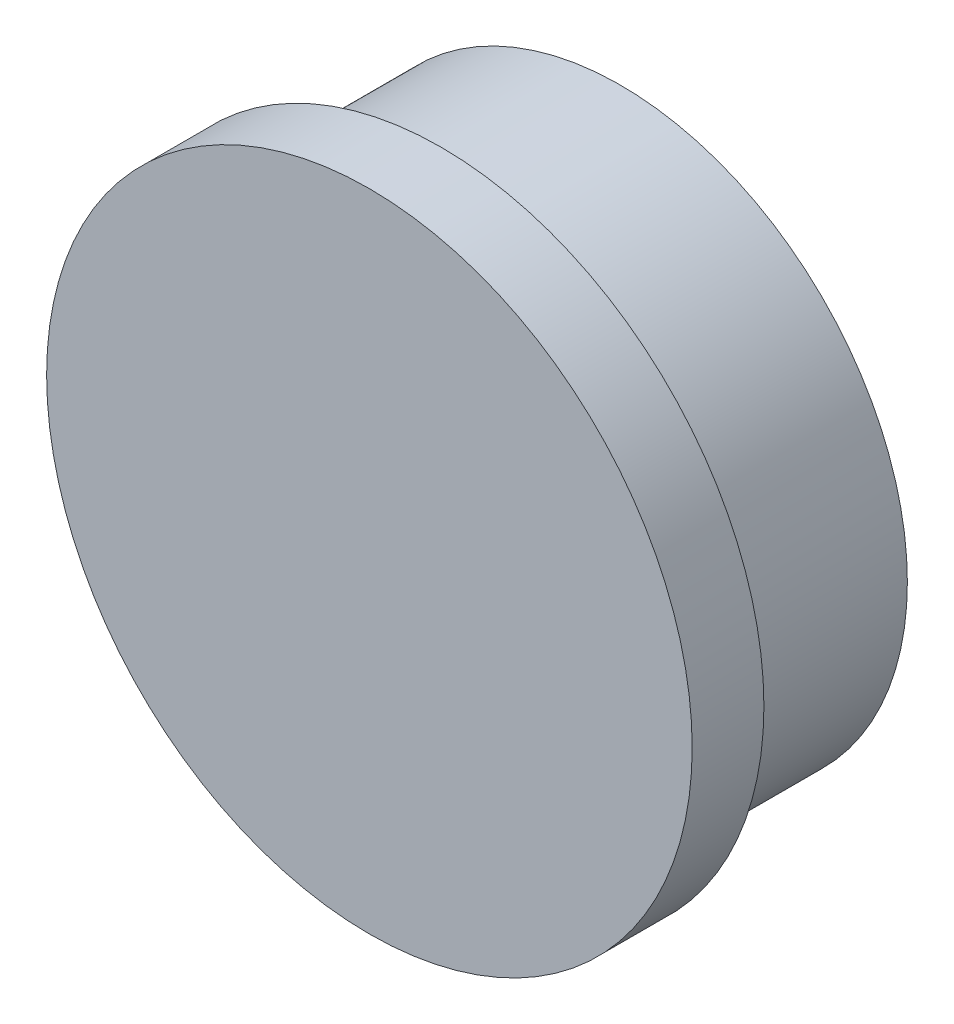
from build123d import *

# Parameters (mm, degrees)
SKETCH_1_R      = 9
EXTRUDE_1_DEPTH = 2
SKETCH_2_R      = 8
EXTRUDE_2_DEPTH = 5


with BuildPart() as part:
    # 草图1 → 凸台-拉伸1 (new body)
    with BuildSketch(Plane.XY):
        Circle(SKETCH_1_R)
    extrude(amount=EXTRUDE_1_DEPTH)

    # 草图2 → 凸台-拉伸2 (add)
    with BuildSketch(Plane.XY):
        Circle(SKETCH_2_R)
    extrude(amount=-EXTRUDE_2_DEPTH)


solid = part.part
